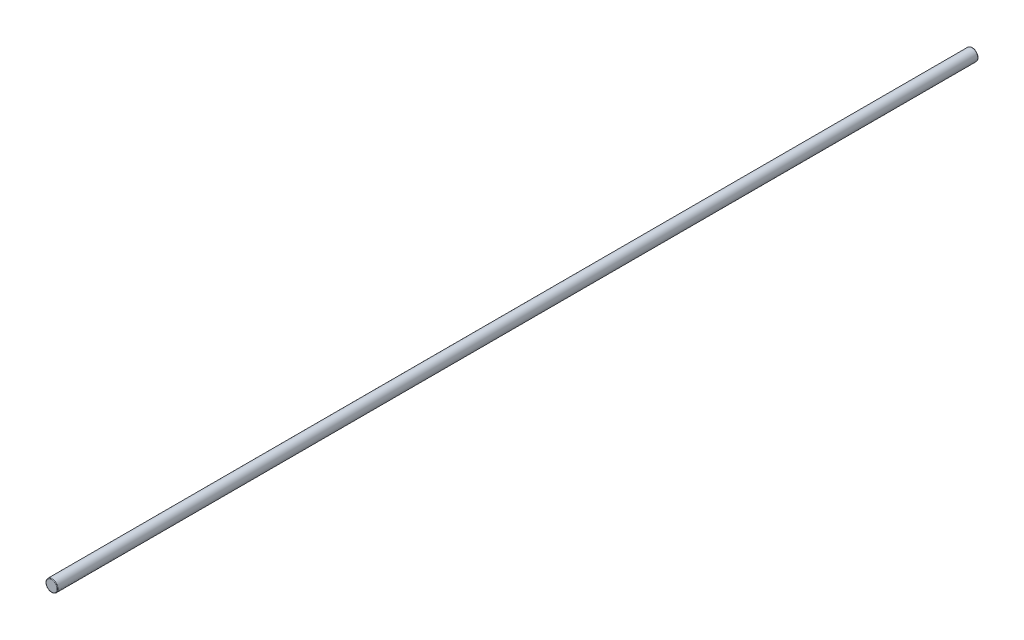
from build123d import *

# Parameters (mm, degrees)
ESQUISSE1_R      = 2.25
EXTRUSION1_DEPTH = 349
CONG_1_R         = 0.2


with BuildPart() as part:
    # Esquisse1 → Extrusion1 (new body)
    with BuildSketch(Plane.XY):
        Circle(ESQUISSE1_R)
    extrude(amount=EXTRUSION1_DEPTH)

    # Congé1
    cong_1_edges = [part.edges().sort_by_distance(p)[0] for p in [
        (-2.25, 0, 0),
        (-2.25, 0, 349),
    ]]
    fillet(cong_1_edges, radius=CONG_1_R)


solid = part.part
